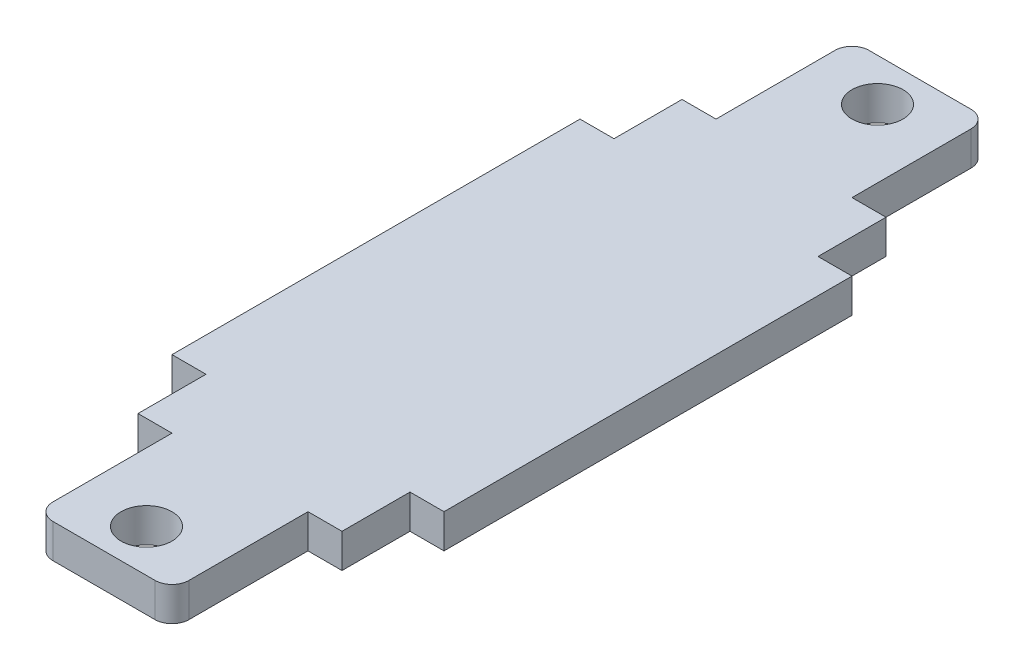
from build123d import *

# Parameters (mm, degrees)
BOSS_EXTRUDE1_DEPTH      = 9.525
BOSS_EXTRUDE1_DEPTH_BACK = 66.675
SKETCH1_W                = 25.4
SKETCH1_H                = 3.175
SKETCH2_W                = 25.4
SKETCH2_H                = 5.678954819
SKETCH2_R                = 2.38125
CUT_EXTRUDE1_DEPTH       = 204.193280927


with BuildPart() as part:
    # Sketch1 → Boss-Extrude1 (new, two sides: drawn at the far end of the back side and taken through both)
    with BuildSketch(Plane.XY.offset(-BOSS_EXTRUDE1_DEPTH_BACK)):
        with Locations((179.216318128, 372.614308443)):
            Rectangle(SKETCH1_W, SKETCH1_H)
    extrude(amount=BOSS_EXTRUDE1_DEPTH + BOSS_EXTRUDE1_DEPTH_BACK)

    # Sketch2 → Cut-Extrude1 (cut, through all)
    with BuildSketch(Plane(origin=(0, 374.201808443, 0), x_dir=(1, 0, 0), z_dir=(0, 1, 0))):
        with BuildLine():
            Line((166.516318128, 57.15), (166.516318128, 47.625))
            Line((166.516318128, 47.625), (169.691318128, 47.625))
            Line((169.691318128, 47.625), (169.691318128, 53.975))
            Line((169.691318128, 53.975), (172.866318128, 53.975))
            Line((172.866318128, 53.975), (172.866318128, 65.0875))
            ThreePointArc((172.866318128, 65.0875), (173.331286113, 66.210032015), (174.453818128, 66.675))
            Line((174.453818128, 66.675), (166.516318128, 66.675))
            Line((166.516318128, 66.675), (166.516318128, 57.15))
        make_face()
        with Locations((179.216318128, 69.51447741)):
            Rectangle(SKETCH2_W, SKETCH2_H)
        with BuildLine():
            Line((188.741318128, 47.625), (191.916318128, 47.625))
            Line((191.916318128, 47.625), (191.916318128, 53.975))
            Line((191.916318128, 53.975), (191.916318128, 66.675))
            Line((191.916318128, 66.675), (183.978818128, 66.675))
            ThreePointArc((183.978818128, 66.675), (185.101350143, 66.210032015), (185.566318128, 65.0875))
            Line((185.566318128, 65.0875), (185.566318128, 53.975))
            Line((185.566318128, 53.975), (188.741318128, 53.975))
            Line((188.741318128, 53.975), (188.741318128, 47.625))
        make_face()
        with Locations(Location((179.216318128, 62.70625, 0), (0, 0, 270))):
            Circle(SKETCH2_R)
        with BuildLine():
            Line((169.691318128, 9.525), (166.516318128, 9.525))
            Line((166.516318128, 9.525), (166.516318128, 0))
            Line((166.516318128, 0), (166.516318128, -9.525))
            Line((166.516318128, -9.525), (174.453818128, -9.525))
            ThreePointArc((174.453818128, -9.525), (173.331286113, -9.060032015), (172.866318128, -7.9375))
            Line((172.866318128, -7.9375), (172.866318128, 3.175))
            Line((172.866318128, 3.175), (169.691318128, 3.175))
            Line((169.691318128, 3.175), (169.691318128, 9.525))
        make_face()
        with Locations((179.216318128, -12.36447741)):
            Rectangle(SKETCH2_W, SKETCH2_H)
        with BuildLine():
            Line((191.916318128, 3.175), (191.916318128, 9.525))
            Line((191.916318128, 9.525), (188.741318128, 9.525))
            Line((188.741318128, 9.525), (188.741318128, 3.175))
            Line((188.741318128, 3.175), (185.566318128, 3.175))
            Line((185.566318128, 3.175), (185.566318128, -7.9375))
            ThreePointArc((185.566318128, -7.9375), (185.101350143, -9.060032015), (183.978818128, -9.525))
            Line((183.978818128, -9.525), (191.916318128, -9.525))
            Line((191.916318128, -9.525), (191.916318128, 3.175))
        make_face()
        with Locations(Location((179.216318128, -5.55625, 0), (0, 0, 90))):
            Circle(SKETCH2_R)
    extrude(amount=-CUT_EXTRUDE1_DEPTH, mode=Mode.SUBTRACT)


solid = part.part
